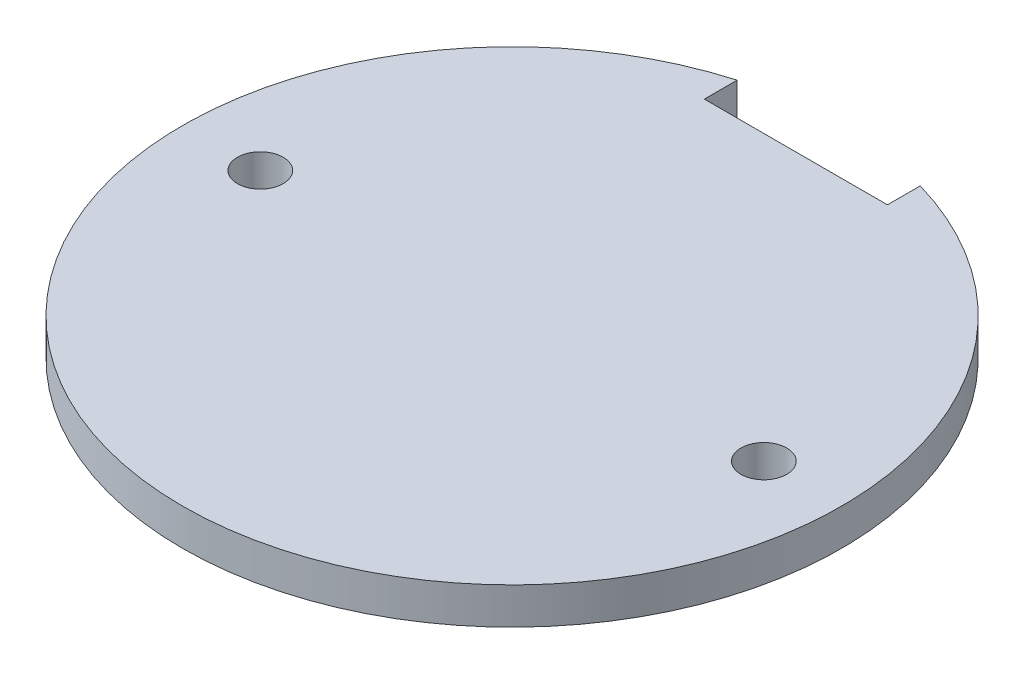
from build123d import *

# Parameters (mm, degrees)
SKETCH1_R           = 2.5
BOSS_EXTRUDE1_DEPTH = 4


with BuildPart() as part:
    # Sketch1 → Boss-Extrude1 (new body)
    with BuildSketch(Plane(origin=(0, 0, 0), x_dir=(1, 0, 0), z_dir=(0, 1, 0))):
        with BuildLine():
            Line((-10, 34.583232932), (-10, 31))
            Line((-10, 31), (10, 31))
            Line((10, 31), (10, 34.583232932))
            ThreePointArc((10, 34.583232932), (0, -36), (-10, 34.583232932))
        make_face()
        with Locations(Location((-27.5, 0, 0), (0, 0, 270))):
            Circle(SKETCH1_R, mode=Mode.SUBTRACT)
        with Locations(Location((27.5, 0, 0), (0, 0, 270))):
            Circle(SKETCH1_R, mode=Mode.SUBTRACT)
    extrude(amount=BOSS_EXTRUDE1_DEPTH)


solid = part.part
